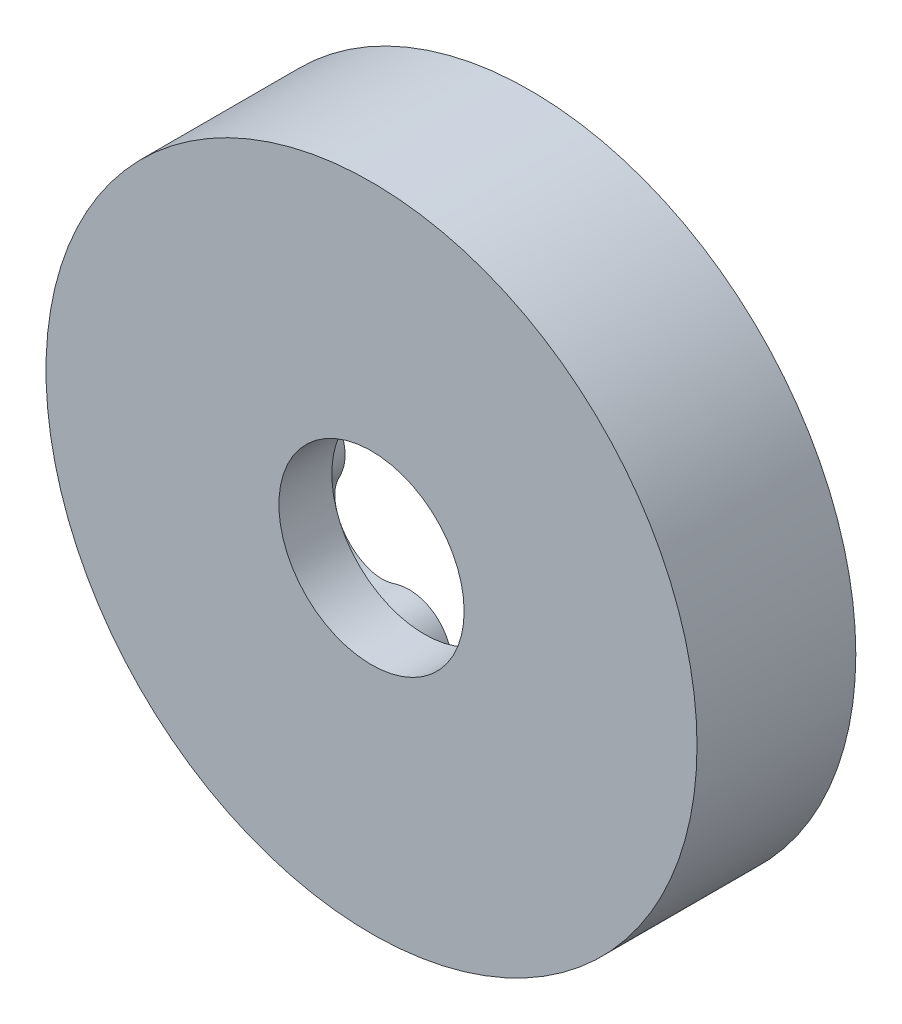
from build123d import *

# Parameters (mm, degrees)
ESQUISSE1_R        = 12.3
BOSS_EXTRU_4_DEPTH = 4
ESQUISSE2_R        = 12.3
ESQUISSE2_R_2      = 3.5
BOSS_EXTRU_5_DEPTH = 2


with BuildPart() as part:
    # Esquisse1 → Boss.-Extru.4 (new body)
    with BuildSketch(Plane.XY):
        Circle(ESQUISSE1_R)
        with BuildLine():
            add(Edge.make_bspline(
                [(7.55, 0), (7.55, -0.022217466), (7.551097377, -0.06660344), (7.556035758, -0.154882158), (7.569167839, -0.254768485), (7.592785481, -0.37435883), (7.631791074, -0.513440089), (7.699599827, -0.686174715), (7.809747013, -0.886363911), (7.938343435, -1.056119454), (8.074367238, -1.199477561), (8.213906261, -1.331108701), (8.363463314, -1.489503642), (8.52117397, -1.760296749), (8.622800912, -2.12120006), (8.639980023, -2.525427279), (8.572560565, -2.925228783), (8.443226846, -3.278721943), (8.236791431, -3.626307028), (7.959315156, -3.92599456), (7.644146129, -4.137037381), (7.344330807, -4.240981402), (7.118477365, -4.261750803), (6.923409824, -4.274042572), (6.729494296, -4.299433334), (6.479039378, -4.361323849), (6.185584384, -4.492786475), (5.900995311, -4.701343321), (5.654616476, -4.994966266), (5.498646357, -5.311447235), (5.420139001, -5.62327233), (5.402679566, -5.880669299), (5.411348006, -6.076048137), (5.43311542, -6.27028614), (5.451881775, -6.496315743), (5.401577193, -6.809624445), (5.248472533, -7.156654923), (5.00151571, -7.481952038), (4.693155209, -7.747259736), (4.362746137, -7.938021502), (3.97880268, -8.072415681), (3.573608703, -8.123638006), (3.196519164, -8.082715292), (2.900033577, -7.969625987), (2.713669376, -7.840359047), (2.556338037, -7.724388907), (2.391469223, -7.619192408), (2.159827187, -7.505614223), (1.850525062, -7.417691062), (1.498459434, -7.394524629), (1.120985101, -7.461083539), (0.798075015, -7.603266401), (0.537497583, -7.791674704), (0.358671298, -7.977629529), (0.239724611, -8.132870358), (0.131545637, -8.295657129), (0.00063247, -8.48086863), (-0.239294028, -8.688541859), (-0.579645892, -8.855968849), (-0.97792275, -8.946420111), (-1.384677099, -8.951447289), (-1.760404432, -8.885196422), (-2.140909097, -8.74135424), (-2.484230767, -8.520139149), (-2.7467935, -8.246402048), (-2.901222232, -7.969193352), (-2.960894305, -7.750376531), (-3.006872934, -7.560407615), (-3.065550767, -7.373846791), (-3.169992211, -7.137944222), (-3.350415467, -6.871775601), (-3.605222288, -6.627725658), (-3.937167647, -6.43607692), (-4.275924503, -6.337432703), (-4.596644926, -6.314265903), (-4.853163255, -6.341768224), (-5.044068602, -6.384232176), (-5.231575792, -6.439397912), (-5.450912809, -6.497128898), (-5.76819685, -6.501993852), (-6.136541661, -6.411476718), (-6.499780125, -6.224758472), (-6.814603855, -5.967153659), (-7.059841778, -5.674888364), (-7.258866454, -5.320117434), (-7.379669823, -4.929970109), (-7.404852791, -4.55150919), (-7.344961354, -4.239881617), (-7.250026908, -4.033914986), (-7.163124623, -3.858808158), (-7.088186053, -3.678236185), (-7.016506455, -3.430291501), (-6.983703661, -3.110565989), (-7.022944536, -2.75014551), (-7.163870523, -2.373055201), (-7.388807145, -2.052464473), (-7.674915576, -1.804887015), (-7.961757696, -1.643613759), (-8.223794342, -1.543858612), (-8.434276899, -1.408170219), (-8.59255306, -1.258153379), (-8.722053282, -1.095509906), (-8.824645601, -0.92839368), (-8.906281505, -0.753480862), (-8.96818609, -0.584253866), (-9.011618341, -0.402056601), (-9.038496186, -0.253381349), (-9.048010833, -0.099975464), (-9.05, -0.033884546), (-9.05, 0)],
                knots=[0.065203343, 0.065203343, 0.065203343, 0.065203343, 0.065203343, 0.068090592, 0.070977842, 0.073865091, 0.076752341, 0.081991863, 0.087231386, 0.094866257, 0.102501127, 0.106027866, 0.109554606, 0.116608084, 0.127054156, 0.141092789, 0.151537705, 0.161982622, 0.17271144, 0.183440258, 0.19705009, 0.20778349, 0.215195934, 0.218902157, 0.222608379, 0.229945233, 0.237282087, 0.248011645, 0.25876192, 0.269512195, 0.280241753, 0.287578607, 0.294915461, 0.298621683, 0.302327905, 0.30974035, 0.32047375, 0.334083582, 0.3448124, 0.355541218, 0.366270036, 0.376998854, 0.390608687, 0.401342087, 0.408754531, 0.412460753, 0.416166975, 0.423503829, 0.430840684, 0.441570242, 0.452320517, 0.463070792, 0.47380035, 0.481137204, 0.488474058, 0.49218028, 0.495886502, 0.503298946, 0.514032347, 0.527642179, 0.538370997, 0.549099815, 0.559828633, 0.570557451, 0.584167283, 0.594900684, 0.602313128, 0.60601935, 0.609725572, 0.617062426, 0.62439928, 0.635128838, 0.645879113, 0.656629388, 0.667358947, 0.674695801, 0.682032655, 0.685738877, 0.689445099, 0.696857543, 0.707590944, 0.721200776, 0.731929594, 0.742658412, 0.75338723, 0.764116048, 0.77772588, 0.78845928, 0.795871725, 0.799577947, 0.803284169, 0.810621023, 0.817957877, 0.828687435, 0.83943771, 0.851255103, 0.863061334, 0.872486065, 0.881910795, 0.888312532, 0.894714268, 0.900613035, 0.906511803, 0.911736381, 0.91696096, 0.922185538, 0.927410117, 0.931813551, 0.936216984, 0.936216984, 0.936216984, 0.936216984, 0.936216984], degree=4))
            add(Edge.make_bspline(
                [(7.55, 0), (7.55, 0.022217466), (7.551097377, 0.06660344), (7.556035758, 0.154882158), (7.569167839, 0.254768485), (7.592785481, 0.37435883), (7.631791074, 0.513440089), (7.699599827, 0.686174715), (7.809747013, 0.886363911), (7.938343435, 1.056119454), (8.074367238, 1.199477561), (8.213906261, 1.331108701), (8.363463314, 1.489503642), (8.52117397, 1.760296749), (8.622800912, 2.12120006), (8.639980023, 2.525427279), (8.572560565, 2.925228783), (8.443226846, 3.278721943), (8.236791431, 3.626307028), (7.959315156, 3.92599456), (7.644146129, 4.137037381), (7.344330807, 4.240981402), (7.118477365, 4.261750803), (6.923409824, 4.274042572), (6.729494296, 4.299433334), (6.479039378, 4.361323849), (6.185584384, 4.492786475), (5.900995311, 4.701343321), (5.654616476, 4.994966266), (5.498646357, 5.311447235), (5.420139001, 5.62327233), (5.402679566, 5.880669299), (5.411348006, 6.076048137), (5.43311542, 6.27028614), (5.451881775, 6.496315743), (5.401577193, 6.809624445), (5.248472533, 7.156654923), (5.00151571, 7.481952038), (4.693155209, 7.747259736), (4.362746137, 7.938021502), (3.97880268, 8.072415681), (3.573608703, 8.123638006), (3.196519164, 8.082715292), (2.900033577, 7.969625986), (2.713669376, 7.840359047), (2.556338037, 7.724388907), (2.391469223, 7.619192408), (2.159827187, 7.505614223), (1.850525062, 7.417691062), (1.498459434, 7.394524629), (1.120985101, 7.461083539), (0.798075015, 7.603266401), (0.537497583, 7.791674704), (0.358671298, 7.977629529), (0.239724611, 8.132870358), (0.131545637, 8.295657129), (0.00063247, 8.48086863), (-0.239294028, 8.688541859), (-0.579645892, 8.855968849), (-0.97792275, 8.946420111), (-1.384677099, 8.951447289), (-1.760404432, 8.885196422), (-2.140909097, 8.74135424), (-2.484230767, 8.520139149), (-2.7467935, 8.246402048), (-2.901222232, 7.969193352), (-2.960894305, 7.750376531), (-3.006872934, 7.560407615), (-3.065550767, 7.373846791), (-3.169992211, 7.137944222), (-3.350415467, 6.871775601), (-3.605222288, 6.627725658), (-3.937167647, 6.43607692), (-4.275924503, 6.337432703), (-4.596644926, 6.314265903), (-4.853163255, 6.341768224), (-5.044068602, 6.384232176), (-5.231575792, 6.439397912), (-5.450912809, 6.497128898), (-5.76819685, 6.501993852), (-6.136541661, 6.411476718), (-6.499780125, 6.224758472), (-6.814603855, 5.967153659), (-7.059841778, 5.674888364), (-7.258866454, 5.320117434), (-7.379669823, 4.929970109), (-7.404852791, 4.55150919), (-7.344961354, 4.239881617), (-7.250026908, 4.033914986), (-7.163124623, 3.858808158), (-7.088186053, 3.678236185), (-7.016506455, 3.430291501), (-6.983703661, 3.110565989), (-7.022944536, 2.75014551), (-7.163870523, 2.373055201), (-7.388807145, 2.052464473), (-7.674915576, 1.804887015), (-7.961757696, 1.643613759), (-8.223794342, 1.543858612), (-8.434276899, 1.408170219), (-8.59255306, 1.258153379), (-8.722053282, 1.095509906), (-8.824645601, 0.92839368), (-8.906281505, 0.753480862), (-8.96818609, 0.584253866), (-9.011618341, 0.402056601), (-9.038496186, 0.253381349), (-9.048010833, 0.099975464), (-9.05, 0.033884546), (-9.05, 0)],
                knots=[0.065203343, 0.065203343, 0.065203343, 0.065203343, 0.065203343, 0.068090592, 0.070977842, 0.073865091, 0.076752341, 0.081991863, 0.087231386, 0.094866257, 0.102501127, 0.106027866, 0.109554606, 0.116608084, 0.127054156, 0.141092789, 0.151537705, 0.161982622, 0.17271144, 0.183440258, 0.19705009, 0.20778349, 0.215195934, 0.218902157, 0.222608379, 0.229945233, 0.237282087, 0.248011645, 0.25876192, 0.269512195, 0.280241753, 0.287578607, 0.294915461, 0.298621683, 0.302327905, 0.30974035, 0.32047375, 0.334083582, 0.3448124, 0.355541218, 0.366270036, 0.376998854, 0.390608687, 0.401342087, 0.408754531, 0.412460753, 0.416166975, 0.423503829, 0.430840684, 0.441570242, 0.452320517, 0.463070792, 0.47380035, 0.481137204, 0.488474058, 0.49218028, 0.495886502, 0.503298946, 0.514032347, 0.527642179, 0.538370997, 0.549099815, 0.559828633, 0.570557451, 0.584167283, 0.594900684, 0.602313128, 0.60601935, 0.609725572, 0.617062426, 0.62439928, 0.635128838, 0.645879113, 0.656629388, 0.667358947, 0.674695801, 0.682032655, 0.685738877, 0.689445099, 0.696857543, 0.707590944, 0.721200776, 0.731929594, 0.742658412, 0.75338723, 0.764116048, 0.77772588, 0.78845928, 0.795871725, 0.799577947, 0.803284169, 0.810621023, 0.817957877, 0.828687435, 0.83943771, 0.851255103, 0.863061334, 0.872486065, 0.881910795, 0.888312532, 0.894714268, 0.900613035, 0.906511803, 0.911736381, 0.91696096, 0.922185538, 0.927410117, 0.931813551, 0.936216984, 0.936216984, 0.936216984, 0.936216984, 0.936216984], degree=4))
        make_face(mode=Mode.SUBTRACT)
    extrude(amount=BOSS_EXTRU_4_DEPTH)

    # Esquisse2 → Boss.-Extru.5 (add)
    with BuildSketch(Plane.XY.offset(4)):
        Circle(ESQUISSE2_R)
        Circle(ESQUISSE2_R_2, mode=Mode.SUBTRACT)
    extrude(amount=BOSS_EXTRU_5_DEPTH)


solid = part.part
